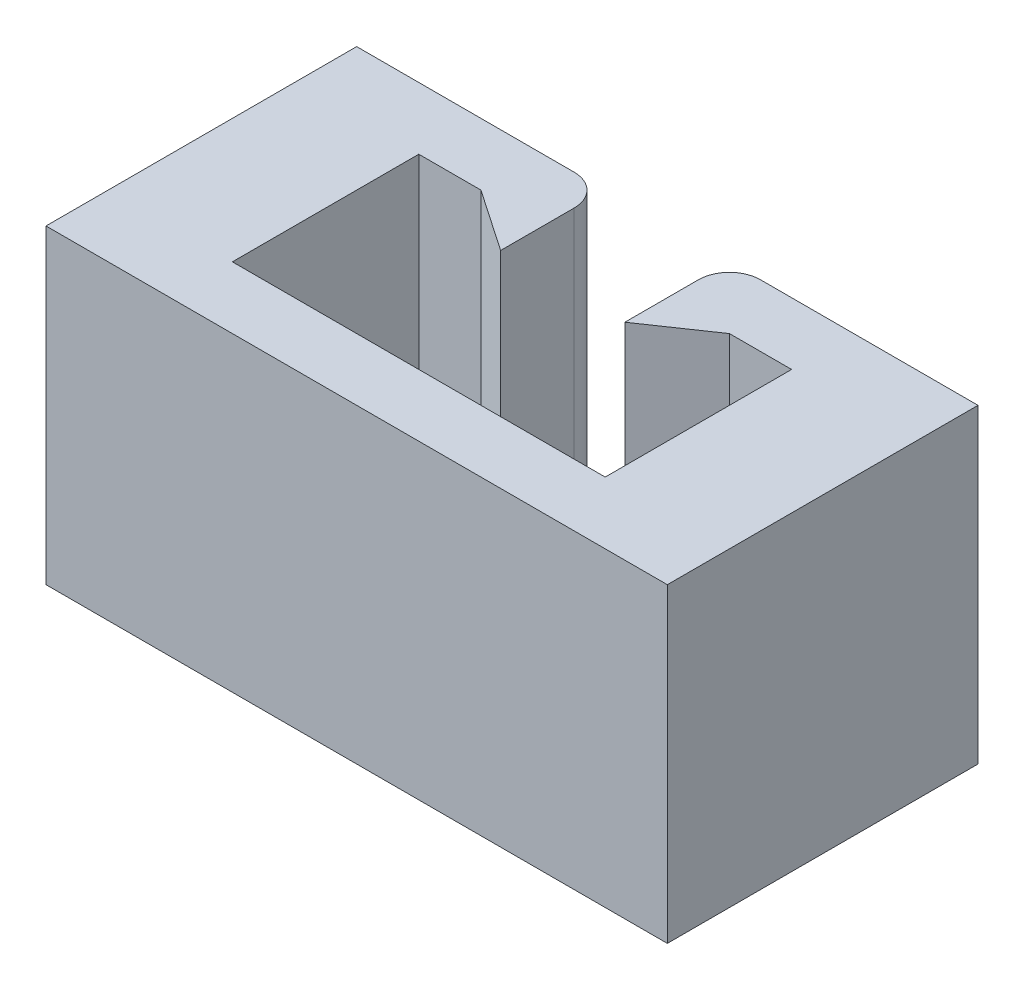
from build123d import *

# Parameters (mm, degrees)
BOSS_EXTRUDE1_DEPTH = 5


with BuildPart() as part:
    # Sketch1 → Boss-Extrude1 (new body)
    with BuildSketch(Plane(origin=(0, 0, 0), x_dir=(1, 0, 0), z_dir=(0, 1, 0))):
        with BuildLine():
            Line((1, 1.5), (1, 0.817081844))
            Line((1, 0.817081844), (2, 1.5))
            Line((2, 1.5), (3, 1.5))
            Line((3, 1.5), (3, -1.5))
            Line((3, -1.5), (-3, -1.5))
            Line((-3, -1.5), (-3, 1.5))
            Line((-3, 1.5), (-2, 1.5))
            Line((-2, 1.5), (-1, 0.817081844))
            Line((-1, 0.817081844), (-1, 1.5))
            Line((-1, 1.5), (-1, 2))
            ThreePointArc((-1, 2), (-1.146446609, 2.353553391), (-1.5, 2.5))
            Line((-1.5, 2.5), (-5, 2.5))
            Line((-5, 2.5), (-5, -2.5))
            Line((-5, -2.5), (5, -2.5))
            Line((5, -2.5), (5, 2.5))
            Line((5, 2.5), (1.5, 2.5))
            ThreePointArc((1.5, 2.5), (1.146446609, 2.353553391), (1, 2))
            Line((1, 2), (1, 1.5))
        make_face()
    extrude(amount=BOSS_EXTRUDE1_DEPTH)


solid = part.part
